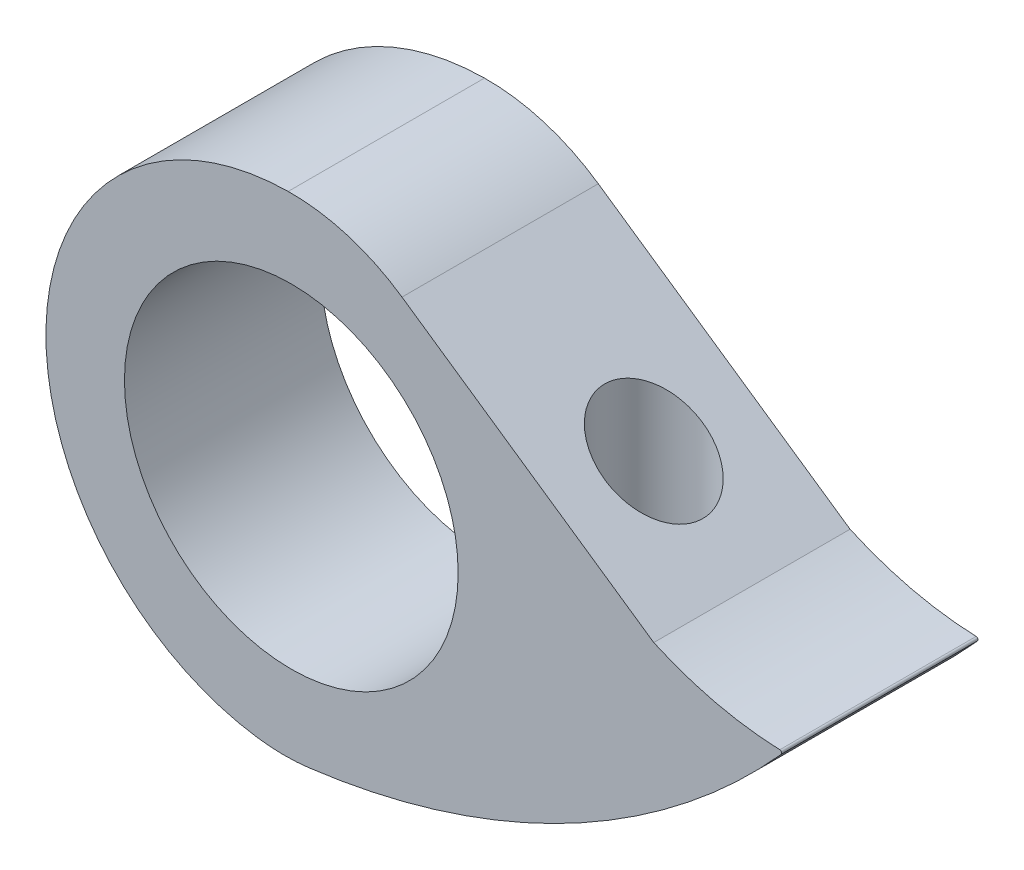
from build123d import *

# Parameters (mm, degrees)
SKETCH1_R               = 2.159
BOSS_EXTRUDE1_DEPTH     = 2.54
FILLET2_R               = 2.54
FILLET3_R               = 0.0254
CUT_EXTRUDE1_DEPTH      = 8.536089729
CUT_EXTRUDE1_DEPTH_BACK = 8.536089729
SKETCH6_R               = 0.635


with BuildPart() as part:
    # Sketch1 → Boss-Extrude1 (new body)
    with BuildSketch(Plane.XY):
        with BuildLine():
            Line((1.03203613, 3.002586623), (4.689867375, 0.484445873))
            ThreePointArc((4.689867375, 0.484445873), (5.512880678, 0.206373406), (6.374728135, 0.097313081))
            ThreePointArc((6.374728135, 0.097313081), (3.49593357, -2.139961579), (0, -3.175))
            ThreePointArc((0, -3.175), (-3.131600033, 0.523169415), (1.03203613, 3.002586623))
        make_face()
        Circle(SKETCH1_R, mode=Mode.SUBTRACT)
    extrude(amount=BOSS_EXTRUDE1_DEPTH)

    # Fillet2
    fillet2_edges = [part.edges().sort_by_distance(p)[0] for p in [
        (1.03203613, 3.002586623, 1.27),
        (0, -3.175, 1.27),
    ]]
    fillet(fillet2_edges, radius=FILLET2_R)

    # Fillet3
    fillet3_edges = [part.edges().sort_by_distance(p)[0] for p in [
        (6.374728135, 0.097313081, 1.27),
    ]]
    fillet(fillet3_edges, radius=FILLET3_R)

    # Sketch6 → Cut-Extrude1 (cut, two sides: drawn at the far end of the back side and taken through both)
    with BuildSketch(Plane(origin=(0, 0, 0), x_dir=(1, 0, 0), z_dir=(0, 1, 0)).offset(-CUT_EXTRUDE1_DEPTH_BACK)):
        with Locations(Location((3.419867375, -1.27, 0), (0, 0, 270))):
            Circle(SKETCH6_R)
    extrude(amount=CUT_EXTRUDE1_DEPTH + CUT_EXTRUDE1_DEPTH_BACK, mode=Mode.SUBTRACT)


solid = part.part
